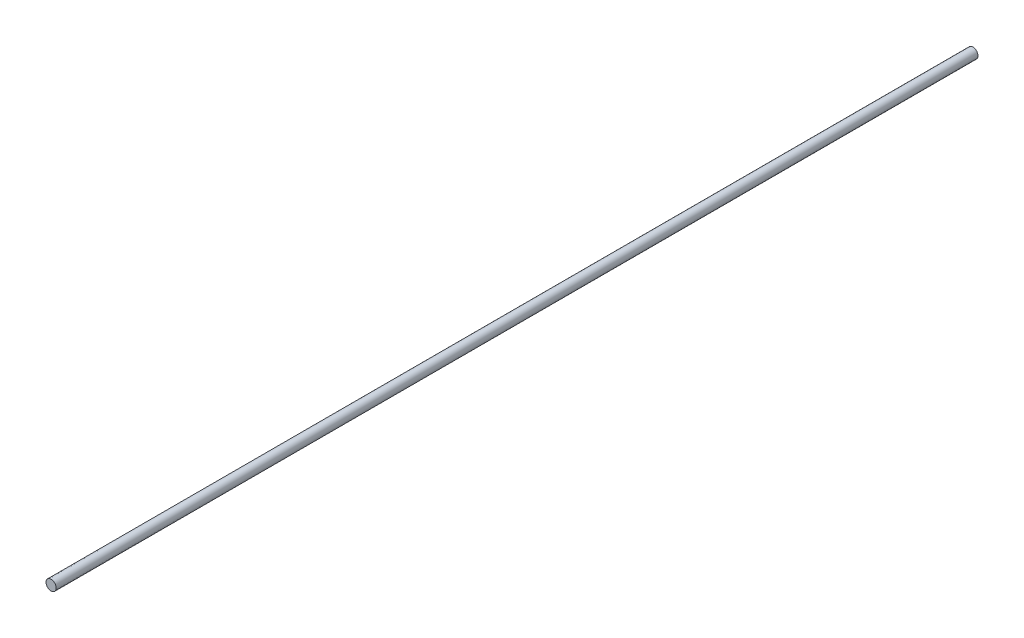
from build123d import *

# Parameters (mm, degrees)
SKETCH_1_R      = 2.2
EXTRUDE_1_DEPTH = 400


with BuildPart() as part:
    # 草图1 → 凸台-拉伸1 (new body)
    with BuildSketch(Plane.XY):
        Circle(SKETCH_1_R)
    extrude(amount=EXTRUDE_1_DEPTH)


solid = part.part
